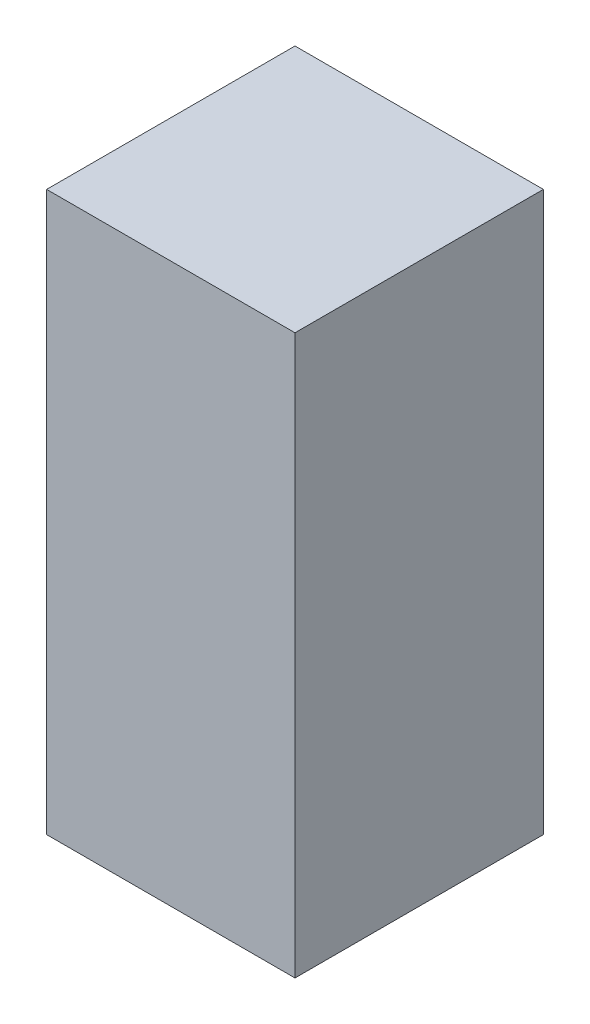
from build123d import *

# Parameters (mm, degrees)
PACK_KOSE_PLOWU_3_1_START = -227.5
SKETCH1_W                 = 20
SKETCH1_H                 = 45
PACK_KOSE_PLOWU_3_1_DEPTH = 20


with BuildPart() as part:
    # Sketch1 → PACK_kose_plowu_3_1 (new body)
    with BuildSketch(Plane.XY.offset(PACK_KOSE_PLOWU_3_1_START)):
        with Locations((187.5, 574.5)):
            Rectangle(SKETCH1_W, SKETCH1_H)
    extrude(amount=-PACK_KOSE_PLOWU_3_1_DEPTH)


solid = part.part
